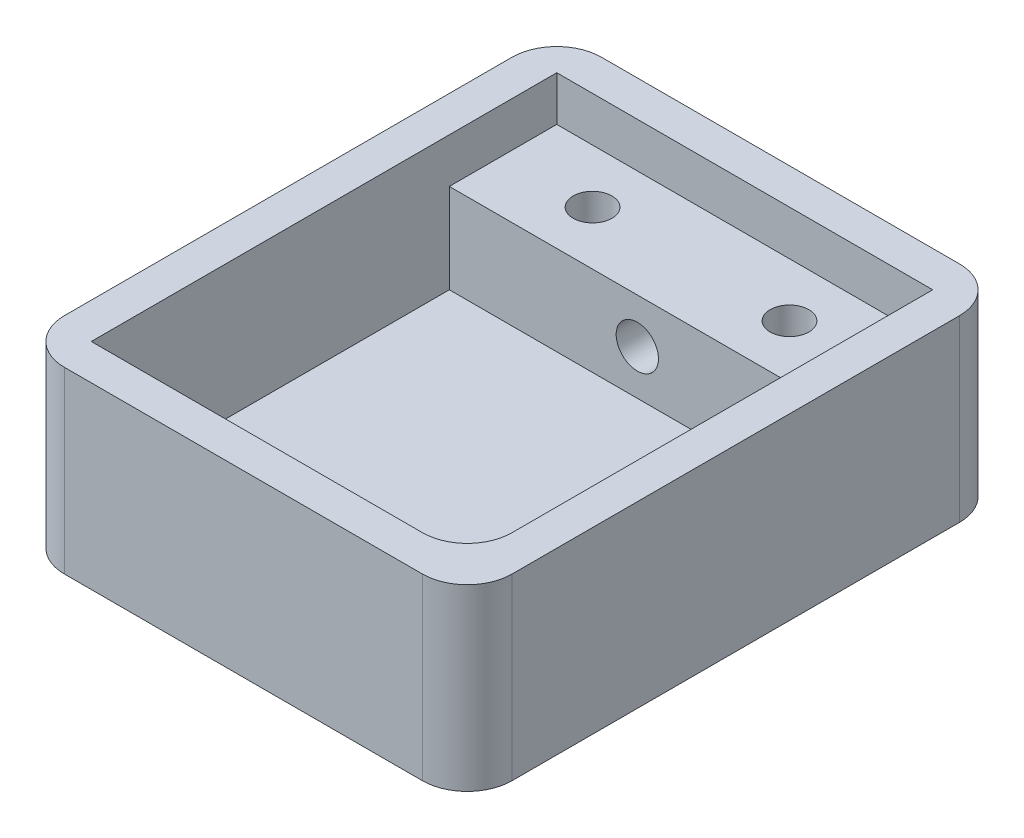
from build123d import *

# Parameters (mm, degrees)
SKETCH1_W           = 31.75
SKETCH1_H           = 38.1
BOSS_EXTRUDE1_DEPTH = 3.175
SKETCH2_W           = 31.75
SKETCH2_H           = 38.1
SKETCH2_W_2         = 26.67
SKETCH2_H_2         = 33.02
BOSS_EXTRUDE2_DEPTH = 9.525
SKETCH3_W           = 26.67
SKETCH3_H           = 7.62
BOSS_EXTRUDE3_DEPTH = 6.35
SKETCH4_R           = 2.749999961
CUT_EXTRUDE1_DEPTH  = 6.35
SKETCH5_R           = 1.375
CUT_EXTRUDE2_DEPTH  = 26.597668351
SKETCH6_R           = 1.5
CUT_EXTRUDE3_DEPTH  = 35.553570365
FILLET1_R           = 3.175


with BuildPart() as part:
    # Sketch1 → Boss-Extrude1 (new body)
    with BuildSketch(Plane(origin=(0, 0, 0), x_dir=(1, 0, 0), z_dir=(0, 1, 0))):
        Rectangle(SKETCH1_W, SKETCH1_H)
    extrude(amount=BOSS_EXTRUDE1_DEPTH)

    # Sketch2 → Boss-Extrude2 (add)
    with BuildSketch(Plane(origin=(0, 3.175, 0), x_dir=(1, 0, 0), z_dir=(0, 1, 0))):
        Rectangle(SKETCH2_W, SKETCH2_H)
        Rectangle(SKETCH2_W_2, SKETCH2_H_2, mode=Mode.SUBTRACT)
    extrude(amount=BOSS_EXTRUDE2_DEPTH)

    # Sketch3 → Boss-Extrude3 (add)
    with BuildSketch(Plane(origin=(0, 3.175, 0), x_dir=(1, 0, 0), z_dir=(0, 1, 0))):
        with Locations((0, 12.7)):
            Rectangle(SKETCH3_W, SKETCH3_H)
    extrude(amount=BOSS_EXTRUDE3_DEPTH)

    # Sketch4 → Cut-Extrude1 (cut)
    with BuildSketch(Plane.XZ):
        with Locations(Location((-6.985, -12.7, 0), (0, 0, 270))):
            Circle(SKETCH4_R)
        with Locations(Location((6.985, -12.7, 0), (0, 0, 270))):
            Circle(SKETCH4_R)
    extrude(amount=-CUT_EXTRUDE1_DEPTH, mode=Mode.SUBTRACT)

    # Sketch5 → Cut-Extrude2 (cut, through all)
    with BuildSketch(Plane.XZ.offset(-6.35)):
        with Locations(Location((6.985, -12.7, 0), (0, 0, 270))):
            Circle(SKETCH5_R)
        with Locations(Location((-6.985, -12.7, 0), (0, 0, 270))):
            Circle(SKETCH5_R)
    extrude(amount=-CUT_EXTRUDE2_DEPTH, mode=Mode.SUBTRACT)

    # Sketch6 → Cut-Extrude3 (cut, through all)
    with BuildSketch(Plane.XY.offset(-8.89)):
        with Locations((0, 6.35)):
            Circle(SKETCH6_R)
    extrude(amount=-CUT_EXTRUDE3_DEPTH, mode=Mode.SUBTRACT)

    # Fillet1
    fillet1_edges = [part.edges().sort_by_distance(p)[0] for p in [
        (13.335, 7.9375, 16.51),
        (15.875, 6.35, 19.05),
        (-15.875, 6.35, 19.05),
        (-15.875, 6.35, -19.05),
        (15.875, 6.35, -19.05),
    ]]
    fillet(fillet1_edges, radius=FILLET1_R)


solid = part.part
